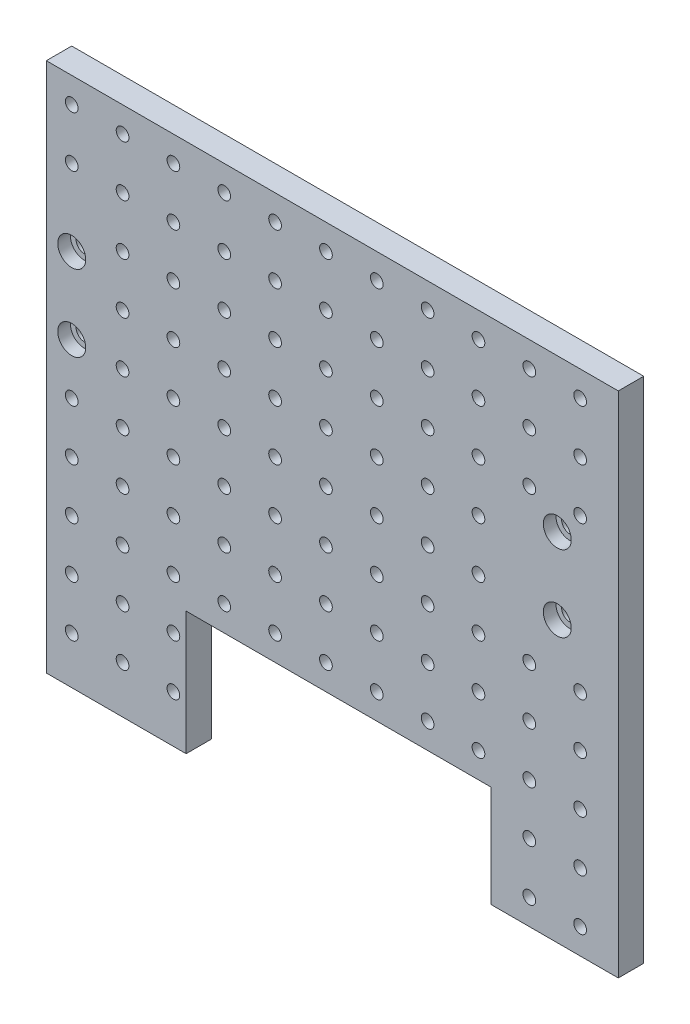
from build123d import *

# Parameters (mm, degrees)
SKETCH1_R           = 3.175
BOSS_EXTRUDE2_DEPTH = 12.7
SKETCH3_R           = 6.985
SKETCH3_R_2         = 4.191
CUT_EXTRUDE1_DEPTH  = 6.35
SKETCH3_3_R         = 4.191
CUT_EXTRUDE2_DEPTH  = 12.7


with BuildPart() as part:
    # Sketch1 → Boss-Extrude2 (new body)
    with BuildSketch(Plane.XY):
        Polygon((69.85, 0), (222.25, 0), (222.25, -50.8), (285.75, -50.8), (285.75, 0), (285.75, 203.2), (0, 203.2), (0, 0), (0, -61.722), (69.85, -61.722), align=None)
        with Locations((12.7, 190.5)):
            Circle(SKETCH1_R, mode=Mode.SUBTRACT)
        with Locations((38.1, 190.5)):
            Circle(SKETCH1_R, mode=Mode.SUBTRACT)
        with Locations((63.5, 190.5)):
            Circle(SKETCH1_R, mode=Mode.SUBTRACT)
        with Locations((88.9, 190.5)):
            Circle(SKETCH1_R, mode=Mode.SUBTRACT)
        with Locations((114.3, 190.5)):
            Circle(SKETCH1_R, mode=Mode.SUBTRACT)
        with Locations((139.7, 190.5)):
            Circle(SKETCH1_R, mode=Mode.SUBTRACT)
        with Locations((165.1, 190.5)):
            Circle(SKETCH1_R, mode=Mode.SUBTRACT)
        with Locations((190.5, 190.5)):
            Circle(SKETCH1_R, mode=Mode.SUBTRACT)
        with Locations((215.9, 190.5)):
            Circle(SKETCH1_R, mode=Mode.SUBTRACT)
        with Locations((241.3, 190.5)):
            Circle(SKETCH1_R, mode=Mode.SUBTRACT)
        with Locations((266.7, 190.5)):
            Circle(SKETCH1_R, mode=Mode.SUBTRACT)
        with Locations((38.1, 165.1)):
            Circle(SKETCH1_R, mode=Mode.SUBTRACT)
        with Locations((63.5, 165.1)):
            Circle(SKETCH1_R, mode=Mode.SUBTRACT)
        with Locations((88.9, 165.1)):
            Circle(SKETCH1_R, mode=Mode.SUBTRACT)
        with Locations((114.3, 165.1)):
            Circle(SKETCH1_R, mode=Mode.SUBTRACT)
        with Locations((139.7, 165.1)):
            Circle(SKETCH1_R, mode=Mode.SUBTRACT)
        with Locations((165.1, 165.1)):
            Circle(SKETCH1_R, mode=Mode.SUBTRACT)
        with Locations((190.5, 165.1)):
            Circle(SKETCH1_R, mode=Mode.SUBTRACT)
        with Locations((215.9, 165.1)):
            Circle(SKETCH1_R, mode=Mode.SUBTRACT)
        with Locations((241.3, 165.1)):
            Circle(SKETCH1_R, mode=Mode.SUBTRACT)
        with Locations((266.7, 165.1)):
            Circle(SKETCH1_R, mode=Mode.SUBTRACT)
        with Locations((38.1, 139.7)):
            Circle(SKETCH1_R, mode=Mode.SUBTRACT)
        with Locations((63.5, 139.7)):
            Circle(SKETCH1_R, mode=Mode.SUBTRACT)
        with Locations((88.9, 139.7)):
            Circle(SKETCH1_R, mode=Mode.SUBTRACT)
        with Locations((114.3, 139.7)):
            Circle(SKETCH1_R, mode=Mode.SUBTRACT)
        with Locations((139.7, 139.7)):
            Circle(SKETCH1_R, mode=Mode.SUBTRACT)
        with Locations((165.1, 139.7)):
            Circle(SKETCH1_R, mode=Mode.SUBTRACT)
        with Locations((190.5, 139.7)):
            Circle(SKETCH1_R, mode=Mode.SUBTRACT)
        with Locations((215.9, 139.7)):
            Circle(SKETCH1_R, mode=Mode.SUBTRACT)
        with Locations((241.3, 139.7)):
            Circle(SKETCH1_R, mode=Mode.SUBTRACT)
        with Locations((266.7, 139.7)):
            Circle(SKETCH1_R, mode=Mode.SUBTRACT)
        with Locations((38.1, 114.3)):
            Circle(SKETCH1_R, mode=Mode.SUBTRACT)
        with Locations((63.5, 114.3)):
            Circle(SKETCH1_R, mode=Mode.SUBTRACT)
        with Locations((88.9, 114.3)):
            Circle(SKETCH1_R, mode=Mode.SUBTRACT)
        with Locations((114.3, 114.3)):
            Circle(SKETCH1_R, mode=Mode.SUBTRACT)
        with Locations((139.7, 114.3)):
            Circle(SKETCH1_R, mode=Mode.SUBTRACT)
        with Locations((165.1, 114.3)):
            Circle(SKETCH1_R, mode=Mode.SUBTRACT)
        with Locations((190.5, 114.3)):
            Circle(SKETCH1_R, mode=Mode.SUBTRACT)
        with Locations((215.9, 114.3)):
            Circle(SKETCH1_R, mode=Mode.SUBTRACT)
        with Locations((38.1, 88.9)):
            Circle(SKETCH1_R, mode=Mode.SUBTRACT)
        with Locations((63.5, 88.9)):
            Circle(SKETCH1_R, mode=Mode.SUBTRACT)
        with Locations((88.9, 88.9)):
            Circle(SKETCH1_R, mode=Mode.SUBTRACT)
        with Locations((114.3, 88.9)):
            Circle(SKETCH1_R, mode=Mode.SUBTRACT)
        with Locations((139.7, 88.9)):
            Circle(SKETCH1_R, mode=Mode.SUBTRACT)
        with Locations((165.1, 88.9)):
            Circle(SKETCH1_R, mode=Mode.SUBTRACT)
        with Locations((190.5, 88.9)):
            Circle(SKETCH1_R, mode=Mode.SUBTRACT)
        with Locations((215.9, 88.9)):
            Circle(SKETCH1_R, mode=Mode.SUBTRACT)
        with Locations((38.1, 63.5)):
            Circle(SKETCH1_R, mode=Mode.SUBTRACT)
        with Locations((63.5, 63.5)):
            Circle(SKETCH1_R, mode=Mode.SUBTRACT)
        with Locations((88.9, 63.5)):
            Circle(SKETCH1_R, mode=Mode.SUBTRACT)
        with Locations((114.3, 63.5)):
            Circle(SKETCH1_R, mode=Mode.SUBTRACT)
        with Locations((139.7, 63.5)):
            Circle(SKETCH1_R, mode=Mode.SUBTRACT)
        with Locations((165.1, 63.5)):
            Circle(SKETCH1_R, mode=Mode.SUBTRACT)
        with Locations((190.5, 63.5)):
            Circle(SKETCH1_R, mode=Mode.SUBTRACT)
        with Locations((215.9, 63.5)):
            Circle(SKETCH1_R, mode=Mode.SUBTRACT)
        with Locations((241.3, 63.5)):
            Circle(SKETCH1_R, mode=Mode.SUBTRACT)
        with Locations((266.7, 63.5)):
            Circle(SKETCH1_R, mode=Mode.SUBTRACT)
        with Locations((38.1, 38.1)):
            Circle(SKETCH1_R, mode=Mode.SUBTRACT)
        with Locations((63.5, 38.1)):
            Circle(SKETCH1_R, mode=Mode.SUBTRACT)
        with Locations((88.9, 38.1)):
            Circle(SKETCH1_R, mode=Mode.SUBTRACT)
        with Locations((114.3, 38.1)):
            Circle(SKETCH1_R, mode=Mode.SUBTRACT)
        with Locations((139.7, 38.1)):
            Circle(SKETCH1_R, mode=Mode.SUBTRACT)
        with Locations((165.1, 38.1)):
            Circle(SKETCH1_R, mode=Mode.SUBTRACT)
        with Locations((190.5, 38.1)):
            Circle(SKETCH1_R, mode=Mode.SUBTRACT)
        with Locations((215.9, 38.1)):
            Circle(SKETCH1_R, mode=Mode.SUBTRACT)
        with Locations((241.3, 38.1)):
            Circle(SKETCH1_R, mode=Mode.SUBTRACT)
        with Locations((38.1, 12.7)):
            Circle(SKETCH1_R, mode=Mode.SUBTRACT)
        with Locations((63.5, 12.7)):
            Circle(SKETCH1_R, mode=Mode.SUBTRACT)
        with Locations((88.9, 12.7)):
            Circle(SKETCH1_R, mode=Mode.SUBTRACT)
        with Locations((114.3, 12.7)):
            Circle(SKETCH1_R, mode=Mode.SUBTRACT)
        with Locations((139.7, 12.7)):
            Circle(SKETCH1_R, mode=Mode.SUBTRACT)
        with Locations((165.1, 12.7)):
            Circle(SKETCH1_R, mode=Mode.SUBTRACT)
        with Locations((190.5, 12.7)):
            Circle(SKETCH1_R, mode=Mode.SUBTRACT)
        with Locations((215.9, 12.7)):
            Circle(SKETCH1_R, mode=Mode.SUBTRACT)
        with Locations((241.3, 12.7)):
            Circle(SKETCH1_R, mode=Mode.SUBTRACT)
        with Locations((38.1, -12.7)):
            Circle(SKETCH1_R, mode=Mode.SUBTRACT)
        with Locations((63.5, -12.7)):
            Circle(SKETCH1_R, mode=Mode.SUBTRACT)
        with Locations((241.3, -12.7)):
            Circle(SKETCH1_R, mode=Mode.SUBTRACT)
        with Locations((266.7, -12.7)):
            Circle(SKETCH1_R, mode=Mode.SUBTRACT)
        with Locations((38.1, -38.1)):
            Circle(SKETCH1_R, mode=Mode.SUBTRACT)
        with Locations((63.5, -38.1)):
            Circle(SKETCH1_R, mode=Mode.SUBTRACT)
        with Locations((241.3, -38.1)):
            Circle(SKETCH1_R, mode=Mode.SUBTRACT)
        with Locations((266.7, -38.1)):
            Circle(SKETCH1_R, mode=Mode.SUBTRACT)
        with Locations((12.7, 165.1)):
            Circle(SKETCH1_R, mode=Mode.SUBTRACT)
        with Locations((12.7, 88.9)):
            Circle(SKETCH1_R, mode=Mode.SUBTRACT)
        with Locations((12.7, 63.5)):
            Circle(SKETCH1_R, mode=Mode.SUBTRACT)
        with Locations((12.7, 38.1)):
            Circle(SKETCH1_R, mode=Mode.SUBTRACT)
        with Locations((12.7, 12.7)):
            Circle(SKETCH1_R, mode=Mode.SUBTRACT)
        with Locations((12.7, -12.7)):
            Circle(SKETCH1_R, mode=Mode.SUBTRACT)
        with Locations((12.7, -38.1)):
            Circle(SKETCH1_R, mode=Mode.SUBTRACT)
        with Locations((266.7, 38.1)):
            Circle(SKETCH1_R, mode=Mode.SUBTRACT)
        with Locations((266.7, 12.7)):
            Circle(SKETCH1_R, mode=Mode.SUBTRACT)
    extrude(amount=BOSS_EXTRUDE2_DEPTH)

    # Sketch3 → Cut-Extrude1 (cut)
    # profile 1 of 4: a face of its own
    with BuildSketch(Plane.XY.offset(12.7)):
        with Locations((255.27, 127)):
            Circle(SKETCH3_R)
        with Locations((255.27, 127)):
            Circle(SKETCH3_R_2, mode=Mode.SUBTRACT)
    # profile 2 of 4: a face of its own
    with BuildSketch(Plane.XY.offset(12.7)):
        with Locations((255.27, 88.9)):
            Circle(SKETCH3_R)
        with Locations((255.27, 88.9)):
            Circle(SKETCH3_R_2, mode=Mode.SUBTRACT)
    # profile 3 of 4: a face of its own
    with BuildSketch(Plane.XY.offset(12.7)):
        with Locations((12.7, 127)):
            Circle(SKETCH3_R)
        with Locations((12.7, 127)):
            Circle(SKETCH3_R_2, mode=Mode.SUBTRACT)
    # profile 4 of 4: a face of its own
    with BuildSketch(Plane.XY.offset(12.7)):
        with Locations((12.7, 88.9)):
            Circle(SKETCH3_R)
        with Locations((12.7, 88.9)):
            Circle(SKETCH3_R_2, mode=Mode.SUBTRACT)
    extrude(amount=-CUT_EXTRUDE1_DEPTH, mode=Mode.SUBTRACT)

    # Sketch3<3> → Cut-Extrude2 (cut)
    with BuildSketch(Plane.XY.offset(12.7)):
        with Locations((255.27, 88.9)):
            Circle(SKETCH3_3_R)
        with Locations((255.27, 127)):
            Circle(SKETCH3_3_R)
        with Locations((12.7, 88.9)):
            Circle(SKETCH3_3_R)
        with Locations((12.7, 127)):
            Circle(SKETCH3_3_R)
    extrude(amount=-CUT_EXTRUDE2_DEPTH, mode=Mode.SUBTRACT)


solid = part.part
